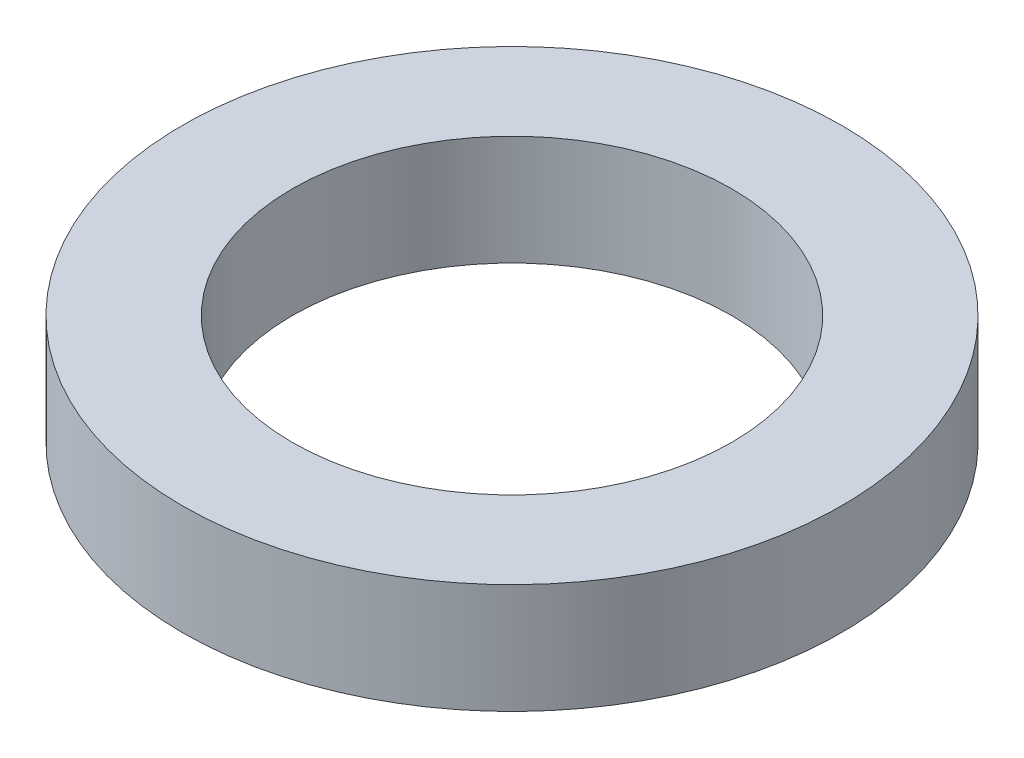
from build123d import *

# Parameters (mm, degrees)
SKETCH1_R           = 9.525
SKETCH1_R_2         = 6.35
BOSS_EXTRUDE1_DEPTH = 3.175


with BuildPart() as part:
    # Sketch1 → Boss-Extrude1 (new body)
    with BuildSketch(Plane(origin=(0, 0, 0), x_dir=(1, 0, 0), z_dir=(0, 1, 0))):
        with Locations(Location((0, 0, 0), (0, 0, 270))):
            Circle(SKETCH1_R)
        with Locations(Location((0, 0, 0), (0, 0, 270))):
            Circle(SKETCH1_R_2, mode=Mode.SUBTRACT)
    extrude(amount=BOSS_EXTRUDE1_DEPTH)


solid = part.part
